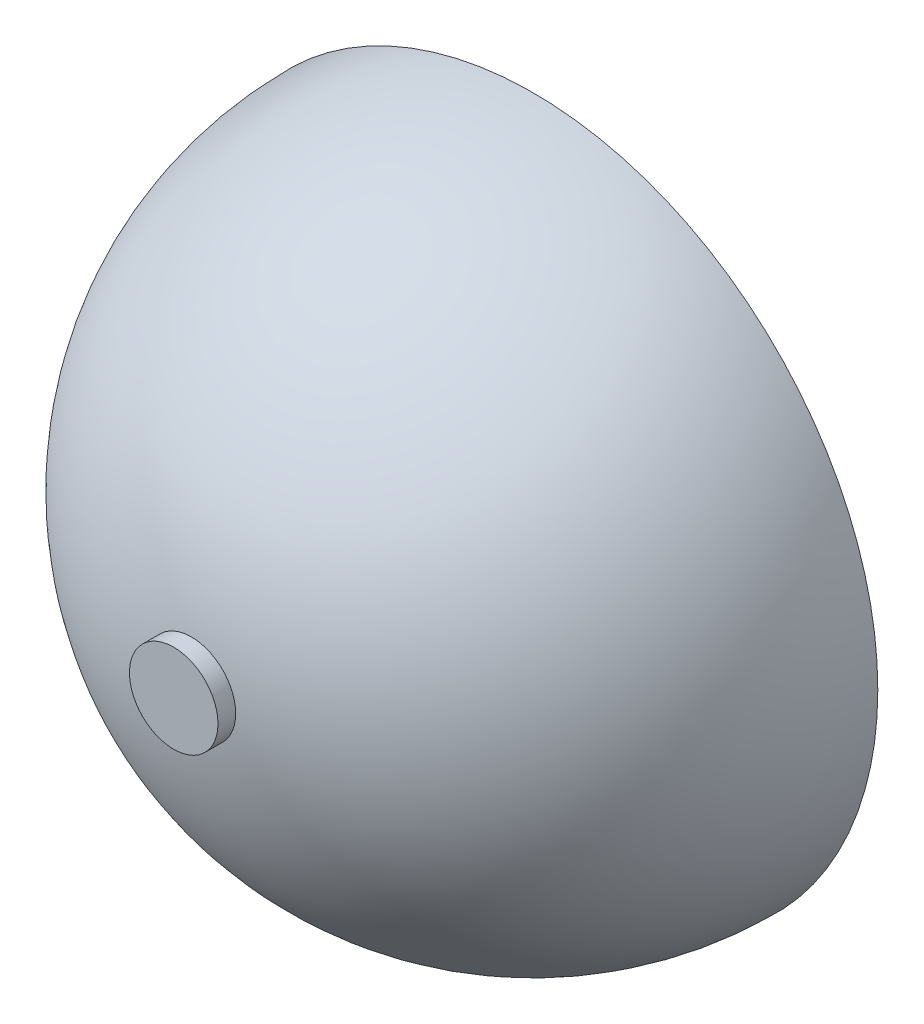
from build123d import *


with BuildPart() as part:
    # Sketch1 → Revolve4 (revolve)
    with BuildSketch(Plane(origin=(0, 0, 0), x_dir=(1, 0, 0), z_dir=(0, 1, 0)), mode=Mode.PRIVATE) as revolve4_sk:
        with BuildLine():
            Line((-17.355747805, 0), (-19.470603363, 0))
            ThreePointArc((-19.470603363, 0), (-14.624994081, -12.853557619), (-2.5, -19.309437985))
            Line((-2.5, -19.309437985), (-2.5, -20.309437985))
            Line((-2.5, -20.309437985), (0, -20.309437985))
            Line((0, -20.309437985), (0, -18.309437985))
            Line((0, -18.309437985), (0, -17.470603363))
            ThreePointArc((0, -17.470603363), (-11.624989788, -13.041533433), (-17.355747805, -2))
            Line((-17.355747805, -2), (-17.355747805, 0))
        make_face()
    revolve(revolve4_sk.sketch.rotate(Axis((0, 0, 14.803174713), (0, 0, 1)), 180), axis=Axis((0, 0, 14.803174713), (0, 0, 1)))


solid = part.part
